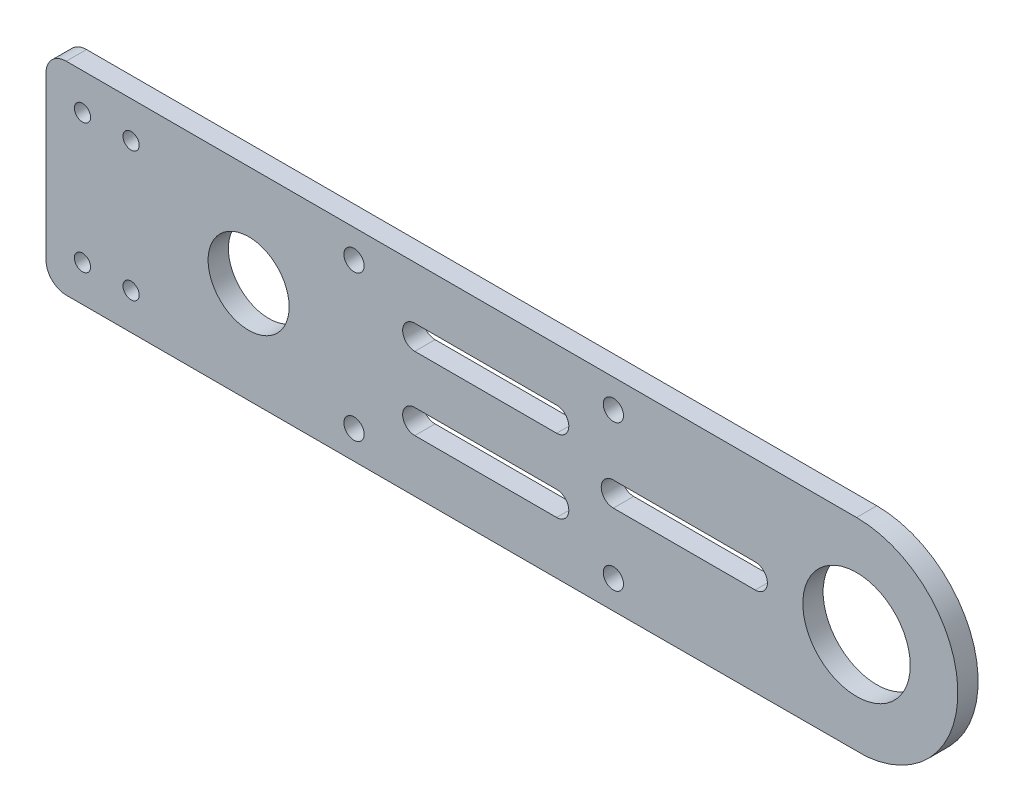
from build123d import *

# Parameters (mm, degrees)
SKETCH_1_R      = 13.25
SKETCH_1_R_2    = 2
SKETCH_1_R_3    = 2.5
SKETCH_1_R_4    = 10
EXTRUDE_1_DEPTH = 5
FILLET_1_R      = 5


with BuildPart() as part:
    # 草图1 → 凸台-拉伸1 (new body)
    with BuildSketch(Plane.XY):
        with BuildLine():
            Line((0, 25), (124.869292101, 25))
            Line((124.869292101, 25), (184, 25))
            ThreePointArc((184, 25), (208.968890762, 1.246793543), (186.490484142, -24.875640469))
            Line((186.490484142, -24.875640469), (124.869292101, -25))
            Line((124.869292101, -25), (0, -25))
            Line((0, -25), (-16, -25))
            Line((-16, -25), (-16, 25))
            Line((-16, 25), (0, 25))
        make_face()
        with Locations((184, 0)):
            Circle(SKETCH_1_R, mode=Mode.SUBTRACT)
        with Locations((5, 16)):
            Circle(SKETCH_1_R_2, mode=Mode.SUBTRACT)
        with Locations(Location((5, -16, 0), (0, 0, 180))):
            Circle(SKETCH_1_R_2, mode=Mode.SUBTRACT)
        with Locations((60, 18)):
            Circle(SKETCH_1_R_3, mode=Mode.SUBTRACT)
        with Locations((124, 18)):
            Circle(SKETCH_1_R_3, mode=Mode.SUBTRACT)
        with Locations((34, 0)):
            Circle(SKETCH_1_R_4, mode=Mode.SUBTRACT)
        with Locations(Location((124, -18, 0), (0, 0, 180))):
            Circle(SKETCH_1_R_3, mode=Mode.SUBTRACT)
        with Locations(Location((60, -18, 0), (0, 0, 180))):
            Circle(SKETCH_1_R_3, mode=Mode.SUBTRACT)
        with Locations((-7, 16)):
            Circle(SKETCH_1_R_2, mode=Mode.SUBTRACT)
        with Locations(Location((-7, -16, 0), (0, 0, 180))):
            Circle(SKETCH_1_R_2, mode=Mode.SUBTRACT)
        with BuildLine():
            Line((75, 12), (110, 12))
            ThreePointArc((110, 12), (113, 9), (110, 6))
            Line((110, 6), (75, 6))
            ThreePointArc((75, 6), (72, 9), (75, 12))
        make_face(mode=Mode.SUBTRACT)
        with BuildLine():
            Line((75, -12), (110, -12))
            ThreePointArc((110, -12), (113, -9), (110, -6))
            Line((110, -6), (75, -6))
            ThreePointArc((75, -6), (72, -9), (75, -12))
        make_face(mode=Mode.SUBTRACT)
        with BuildLine():
            Line((124, 3), (159, 3))
            ThreePointArc((159, 3), (162, 0), (159, -3))
            Line((159, -3), (124, -3))
            ThreePointArc((124, -3), (121, 0), (124, 3))
        make_face(mode=Mode.SUBTRACT)
    extrude(amount=EXTRUDE_1_DEPTH)

    # 圆角1
    fillet_1_edges = [part.edges().sort_by_distance(p)[0] for p in [
        (-16, -25, 2.5),
        (-16, 25, 2.5),
    ]]
    fillet(fillet_1_edges, radius=FILLET_1_R)


solid = part.part
